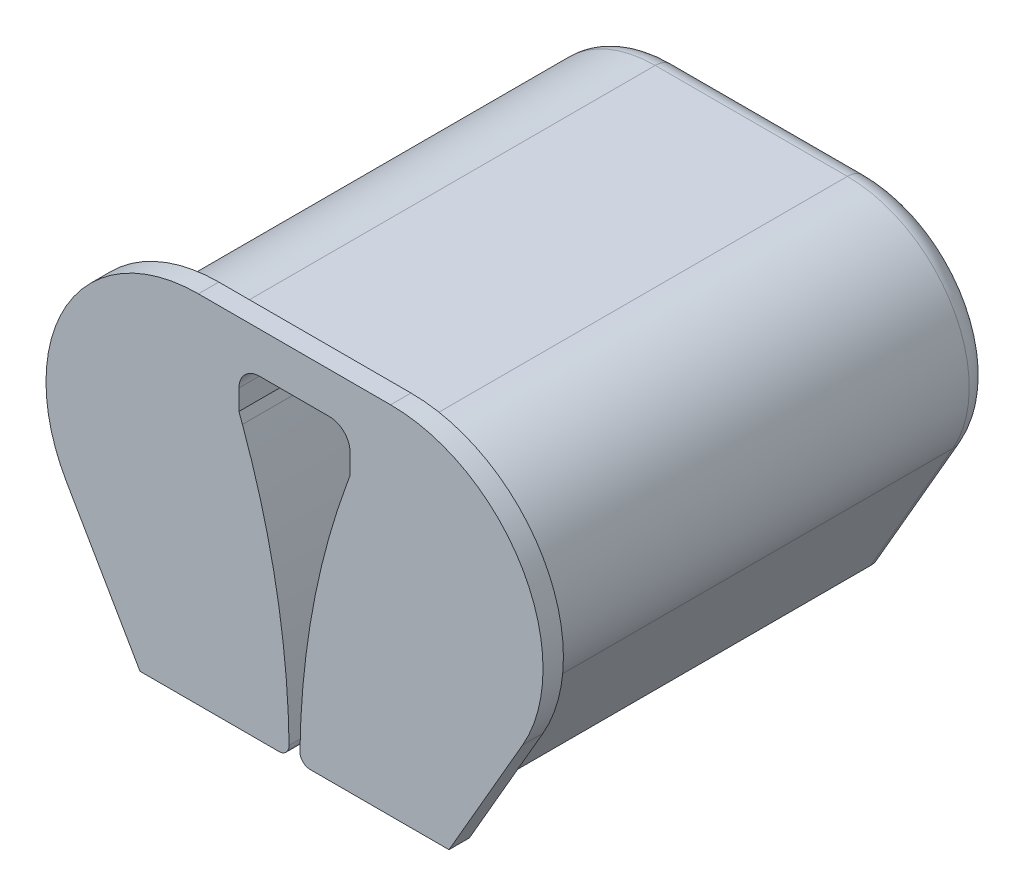
from build123d import *

# Parameters (mm, degrees)
BOSS_EXTRUDE1_DEPTH     = 44.9
FILLET1_R               = 2.1
BOSS_EXTRUDE2_DEPTH     = 2
CUT_EXTRUDE1_DEPTH      = 61.269699517
CUT_EXTRUDE1_DEPTH_BACK = 61.269699517
FILLET2_R               = 1


with BuildPart() as part:
    # Sketch1 → Boss-Extrude1 (new body)
    with BuildSketch(Plane.XY):
        with BuildLine():
            Line((-11.688749537, -31.975), (-19.771653306, -17.975))
            ThreePointArc((-19.771653306, -17.975), (-19.771653306, -6.025), (-9.422649731, -0.05))
            Line((-9.422649731, -0.05), (9.422649731, -0.05))
            ThreePointArc((9.422649731, -0.05), (19.771653306, -6.025), (19.771653306, -17.975))
            Line((19.771653306, -17.975), (11.688749537, -31.975))
            Line((11.688749537, -31.975), (-11.688749537, -31.975))
        make_face()
    extrude(amount=-BOSS_EXTRUDE1_DEPTH)

    # Fillet1
    fillet1_edges = [part.edges().sort_by_distance(p)[0] for p in [
        (15.730201422, -24.975, -44.9),
        (19.771653306, -6.025, -44.9),
        (0, -0.05, -44.9),
        (-19.771653306, -6.025, -44.9),
        (-15.730201422, -24.975, -44.9),
    ]]
    fillet(fillet1_edges, radius=FILLET1_R)

    # Sketch2 → Boss-Extrude2 (add)
    with BuildSketch(Plane.XY):
        with BuildLine():
            Line((15.152851153, -31.975), (22.369729517, -19.475))
            ThreePointArc((22.369729517, -19.475), (22.369729517, -4.525), (9.422649731, 2.95))
            Line((9.422649731, 2.95), (-9.422649731, 2.95))
            ThreePointArc((-9.422649731, 2.95), (-22.369729517, -4.525), (-22.369729517, -19.475))
            Line((-22.369729517, -19.475), (-15.152851153, -31.975))
            Line((-15.152851153, -31.975), (15.152851153, -31.975))
        make_face()
    extrude(amount=BOSS_EXTRUDE2_DEPTH)

    # Sketch3 → Cut-Extrude1 (cut, two sides: drawn at the far end of the back side and taken through both)
    with BuildSketch(Plane.XY.offset(-CUT_EXTRUDE1_DEPTH_BACK)):
        with BuildLine():
            Line((-3.447387849, -1.05), (3.447387849, -1.05))
            ThreePointArc((3.447387849, -1.05), (4.861601412, -1.635786438), (5.447387849, -3.05))
            Line((5.447387849, -3.05), (5.447387849, -5.05))
            Line((5.447387849, -5.05), (5.10836082, -5.981469107))
            ThreePointArc((5.10836082, -5.981469107), (1.679610771, -18.777738497), (0.525, -31.975))
            Line((0.525, -31.975), (-0.525, -31.975))
            ThreePointArc((-0.525, -31.975), (-1.679610771, -18.777738497), (-5.10836082, -5.981469107))
            Line((-5.10836082, -5.981469107), (-5.447387849, -5.05))
            Line((-5.447387849, -5.05), (-5.447387849, -3.05))
            ThreePointArc((-5.447387849, -3.05), (-4.861601412, -1.635786438), (-3.447387849, -1.05))
        make_face()
    extrude(amount=CUT_EXTRUDE1_DEPTH + CUT_EXTRUDE1_DEPTH_BACK, mode=Mode.SUBTRACT)

    # Fillet2
    fillet2_edges = [part.edges().sort_by_distance(p)[0] for p in [
        (-0.525, -31.975, -21.45),
        (0.525, -31.975, -21.45),
    ]]
    fillet(fillet2_edges, radius=FILLET2_R)


solid = part.part
